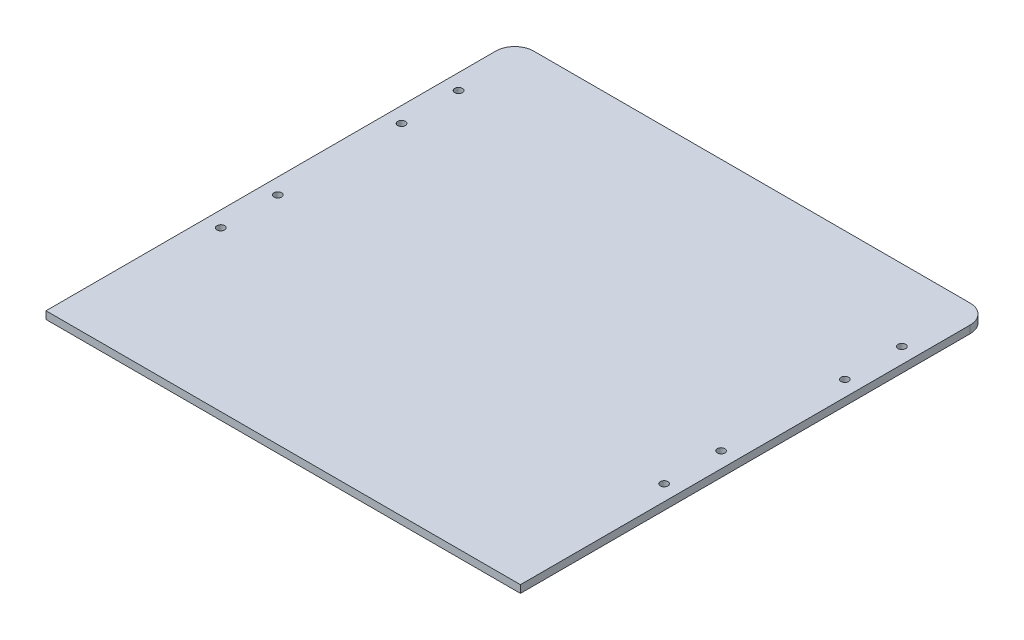
from build123d import *

# Parameters (mm, degrees)
SALIENTE_EXTRUIR1_DEPTH = 2
CROQUIS2_R              = 2
CORTAR_EXTRUIR1_DEPTH   = 10


with BuildPart() as part:
    # Croquis1 → Saliente-Extruir1 (new, symmetric)
    with BuildSketch(Plane(origin=(0, 0, 0), x_dir=(1, 0, 0), z_dir=(0, 1, 0))):
        with BuildLine():
            Line((-125, -123.5), (125, -123.5))
            Line((125, -123.5), (125, 113.5))
            ThreePointArc((125, 113.5), (122.071067812, 120.571067812), (115, 123.5))
            Line((115, 123.5), (-115, 123.5))
            ThreePointArc((-115, 123.5), (-122.071067812, 120.571067812), (-125, 113.5))
            Line((-125, 113.5), (-125, -123.5))
        make_face()
    extrude(amount=SALIENTE_EXTRUIR1_DEPTH, both=True)

    # Croquis2 → Cortar-Extruir1 (cut)
    with BuildSketch(Plane(origin=(0, 2, 0), x_dir=(1, 0, 0), z_dir=(0, 1, 0))):
        with Locations(Location((-116.8, 85.7, 0), (0, 0, 270))):
            Circle(CROQUIS2_R)
        with Locations(Location((-116.8, 55.65, 0), (0, 0, 270))):
            Circle(CROQUIS2_R)
        with Locations(Location((-116.8, -9.554160022, 0), (0, 0, 270))):
            Circle(CROQUIS2_R)
        with Locations(Location((-116.8, -39.6, 0), (0, 0, 270))):
            Circle(CROQUIS2_R)
        with Locations(Location((116.8, -39.6, 0), (0, 0, 90))):
            Circle(CROQUIS2_R)
        with Locations(Location((116.8, -9.554160022, 0), (0, 0, 90))):
            Circle(CROQUIS2_R)
        with Locations(Location((116.8, 55.65, 0), (0, 0, 90))):
            Circle(CROQUIS2_R)
        with Locations(Location((116.8, 85.7, 0), (0, 0, 90))):
            Circle(CROQUIS2_R)
    extrude(amount=-CORTAR_EXTRUIR1_DEPTH, mode=Mode.SUBTRACT)


solid = part.part
